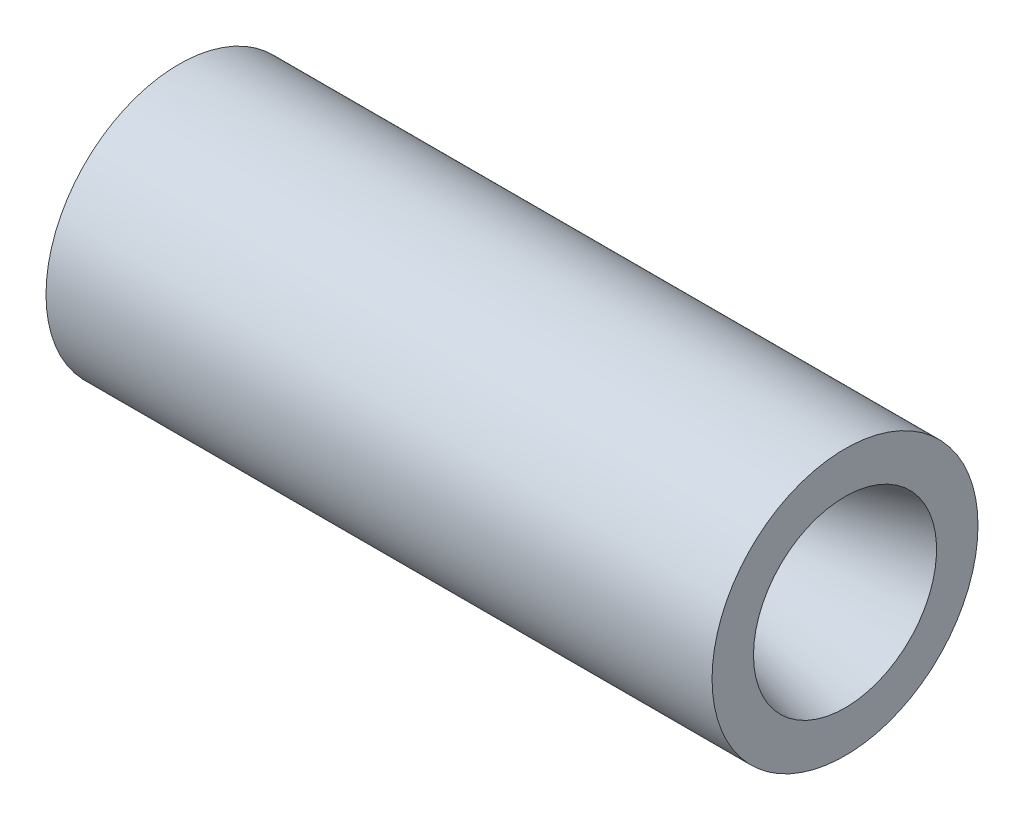
from build123d import *


with BuildPart() as part:
    # Sketch1 → Revolve2 (revolve)
    with BuildSketch(Plane.XY, mode=Mode.PRIVATE) as revolve2_sk:
        with BuildLine():
            Line((0, 43.2765708), (142.96691498, 43.2765708))
            ThreePointArc((142.96691498, 43.2765708), (148.071235766, 42.49094069), (152.703069491, 40.206773074))
            Line((152.703069491, 40.206773074), (181.498115051, 20.04426511))
            ThreePointArc((181.498115051, 20.04426511), (188.286684234, 17.232347685), (195.627585002, 17.552858335))
            Line((195.627585002, 17.552858335), (267.174286043, 36.7237391))
            Line((267.174286043, 36.7237391), (267.174286043, 53.34))
            Line((267.174286043, 53.34), (0, 53.34))
            Line((0, 53.34), (0, 43.2765708))
        make_face()
    revolve(revolve2_sk.sketch.rotate(Axis((0, 0, 0), (1, 0, 0)), 90), axis=Axis((0, 0, 0), (1, 0, 0)))


solid = part.part
